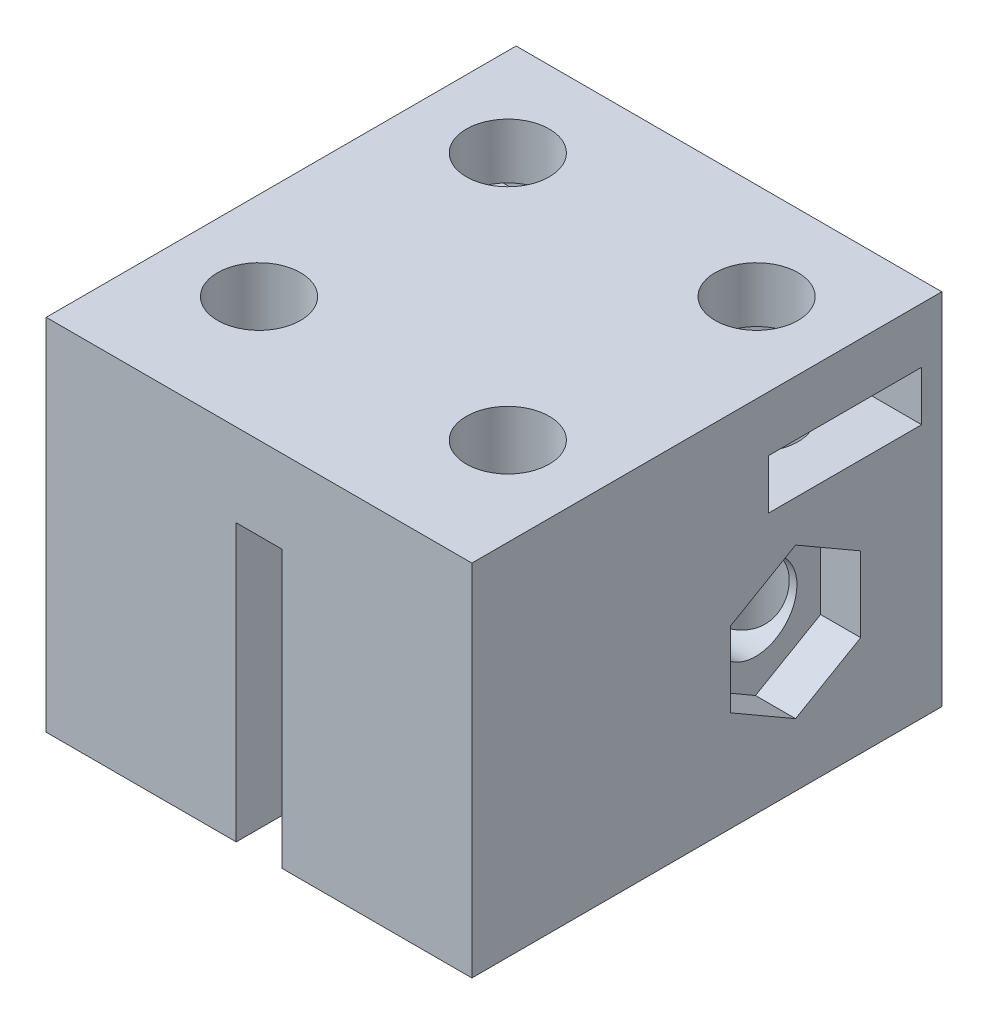
from build123d import *
from build123d.topology import SkipClean

# Parameters (mm, degrees)
BOSS_EXTRUDE1_DEPTH     = 17
SKETCH3_R               = 1.5
CUT_EXTRUDE1_DEPTH      = 27.365887051
SKETCH4_3_R             = 1.5
CUT_EXTRUDE3_DEPTH      = 1.8
CUT_EXTRUDE2_DEPTH      = 26.439339614
CUT_EXTRUDE2_DEPTH_BACK = 26.439339614
SKETCH4_R               = 1.5
SKETCH3_3_R             = 1.5
CUT_EXTRUDE4_DEPTH      = 1.45
SKETCH6_W               = 5.542562584
SKETCH6_H               = 1.8
CUT_EXTRUDE5_DEPTH      = 3.2
SKETCH7_W               = 2.771281292
SKETCH7_H               = 1.8
CUT_EXTRUDE6_DEPTH      = 24.538054295


with BuildPart() as part:
    # Sketch2 → Boss-Extrude1 (new body)
    with BuildSketch(Plane.XY):
        Polygon((0, 0), (6.875, 0), (6.875, 10), (8.525, 10), (8.525, 0), (15.4, 0), (15.4, 13), (0, 13), align=None)
    extrude(amount=-BOSS_EXTRUDE1_DEPTH)

    # Sketch3 → Cut-Extrude1 (cut, through all)
    with BuildSketch(Plane(origin=(15.4, 0, 0), x_dir=(0, 0, -1), z_dir=(1, 0, 0))):
        with Locations(Location((11.71, 4.99, 0), (0, 0, 90))):
            Circle(SKETCH3_R)
    extrude(amount=-CUT_EXTRUDE1_DEPTH, mode=Mode.SUBTRACT)

    # Sketch4<3> → Cut-Extrude3 (cut)
    # profile 1 of 4: a face of its own
    with BuildSketch(Plane(origin=(0, 11, 0), x_dir=(1, 0, 0), z_dir=(0, 1, 0))):
        with Locations(Location((3.2, 4.5, 0), (0, 0, 180))):
            Circle(SKETCH4_3_R)
    # profile 2 of 4: a face of its own
    with BuildSketch(Plane(origin=(0, 11, 0), x_dir=(1, 0, 0), z_dir=(0, 1, 0))):
        with Locations((12.2, 4.5)):
            Circle(SKETCH4_3_R)
    # profile 3 of 4: a face of its own
    with BuildSketch(Plane(origin=(0, 11, 0), x_dir=(1, 0, 0), z_dir=(0, 1, 0))):
        Polygon((9.8, 12.114359354), (9.8, 14.885640646), (12.2, 16.271281292), (14.6, 14.885640646), (14.6, 12.114359354), (12.2, 10.728718708), align=None)
        with Locations((12.2, 13.5)):
            Circle(SKETCH4_3_R, mode=Mode.SUBTRACT)
    # profile 4 of 4: a face of its own
    with BuildSketch(Plane(origin=(0, 11, 0), x_dir=(1, 0, 0), z_dir=(0, 1, 0))):
        Polygon((3.2, 16.271281292), (0.8, 14.885640646), (0.8, 12.114359354), (3.2, 10.728718708), (5.6, 12.114359354), (5.6, 14.885640646), align=None)
        with Locations(Location((3.2, 13.5, 0), (0, 0, 180))):
            Circle(SKETCH4_3_R, mode=Mode.SUBTRACT)
    extrude(amount=-CUT_EXTRUDE3_DEPTH, mode=Mode.SUBTRACT)

    # Sketch4 → Cut-Extrude2 (cut, two sides: drawn at the far end of the back side and taken through both)
    with SkipClean():  # the faces are left unmerged after this step: merging them gives an invalid solid
        with BuildSketch(Plane(origin=(0, 11, 0), x_dir=(1, 0, 0), z_dir=(0, 1, 0)).offset(-CUT_EXTRUDE2_DEPTH_BACK)):
            with Locations(Location((3.2, 13.5, 0), (0, 0, 180))):
                Circle(SKETCH4_R)
            with Locations(Location((12.2, 13.5, 0), (0, 0, 180))):
                Circle(SKETCH4_R)
            with Locations(Location((3.2, 4.5, 0), (0, 0, 180))):
                Circle(SKETCH4_R)
            with Locations(Location((12.2, 4.5, 0), (0, 0, 180))):
                Circle(SKETCH4_R)
        extrude(amount=CUT_EXTRUDE2_DEPTH + CUT_EXTRUDE2_DEPTH_BACK, mode=Mode.SUBTRACT)

    # Sketch3<3> → Cut-Extrude4 (cut)
    with SkipClean():  # the faces are left unmerged after this step: merging them gives an invalid solid
        with BuildSketch(Plane(origin=(15.4, 0, 0), x_dir=(0, 0, -1), z_dir=(1, 0, 0))):
            Polygon((14.065, 3.630340116), (11.71, 2.270680232), (9.355, 3.630340116), (9.355, 6.349659884), (11.71, 7.709319768), (14.065, 6.349659884), align=None)
            with Locations(Location((11.71, 4.99, 0), (0, 0, 90))):
                Circle(SKETCH3_3_R, mode=Mode.SUBTRACT)
        cut_extrude4 = extrude(amount=-CUT_EXTRUDE4_DEPTH, mode=Mode.SUBTRACT)

    # Mirror1: Cut-Extrude4 across plane
    with SkipClean():  # the faces are left unmerged after this step: merging them gives an invalid solid
        add(cut_extrude4.mirror(Plane(origin=(7.7, 0, 0), x_dir=(0, 0, 1), z_dir=(1, 0, 0))), mode=Mode.SUBTRACT)

    # Sketch6 → Cut-Extrude5 (cut)
    with SkipClean():  # the faces are left unmerged after this step: merging them gives an invalid solid
        with BuildSketch(Plane.ZY):
            with Locations((-13.5, 10.1)):
                Rectangle(SKETCH6_W, SKETCH6_H)
        cut_extrude5 = extrude(amount=-CUT_EXTRUDE5_DEPTH, mode=Mode.SUBTRACT)

    # Sketch7 → Cut-Extrude6 (cut, through all)
    with SkipClean():  # the faces are left unmerged after this step: merging them gives an invalid solid
        with BuildSketch(Plane.ZY.offset(-5.6)):
            with Locations((-13.5, 10.1)):
                Rectangle(SKETCH7_W, SKETCH7_H)
        extrude(amount=-CUT_EXTRUDE6_DEPTH, mode=Mode.SUBTRACT)

    # Mirror2: Cut-Extrude5 across plane
    with SkipClean():  # the faces are left unmerged after this step: merging them gives an invalid solid
        add(cut_extrude5.mirror(Plane(origin=(7.7, 0, 0), x_dir=(0, 0, 1), z_dir=(1, 0, 0))), mode=Mode.SUBTRACT)


solid = part.part
